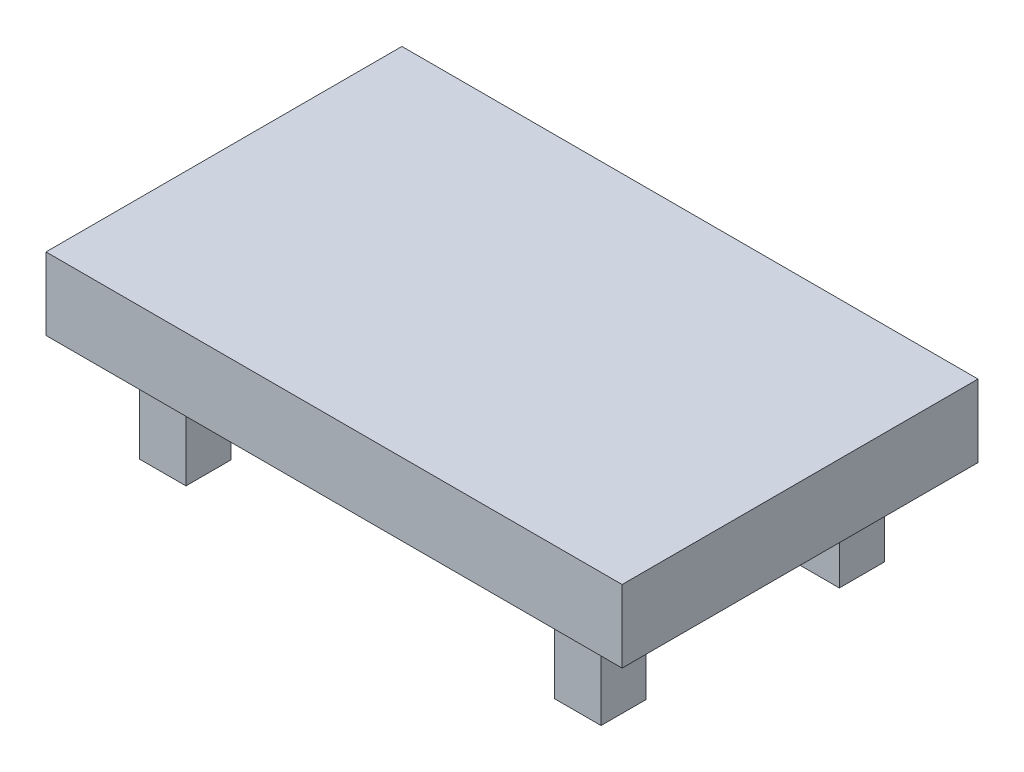
from build123d import *

# Parameters (mm, degrees)
SKETCH1_W      = 2425.7
SKETCH1_H      = 1498.6
EXTRUDE1_DEPTH = 304.8
SKETCH2_W      = 195.697690122
SKETCH2_H      = 190.200978844
EXTRUDE2_DEPTH = 406.4


with BuildPart() as part:
    # Sketch1 → Extrude1 (new body)
    with BuildSketch(Plane(origin=(0, 0, 0), x_dir=(1, 0, 0), z_dir=(0, 1, 0))):
        Rectangle(SKETCH1_W, SKETCH1_H)
    extrude(amount=EXTRUDE1_DEPTH)

    # Sketch2 → Extrude2 (add)
    with BuildSketch(Plane.XZ):
        with Locations((873.896069805, 501.711153283)):
            Rectangle(SKETCH2_W, SKETCH2_H)
        with Locations((-873.896069805, 501.711153283)):
            Rectangle(SKETCH2_W, SKETCH2_H)
        with Locations((-873.896069805, -501.711153283)):
            Rectangle(SKETCH2_W, SKETCH2_H)
        with Locations((873.896069805, -501.711153283)):
            Rectangle(SKETCH2_W, SKETCH2_H)
    extrude(amount=EXTRUDE2_DEPTH)


solid = part.part
